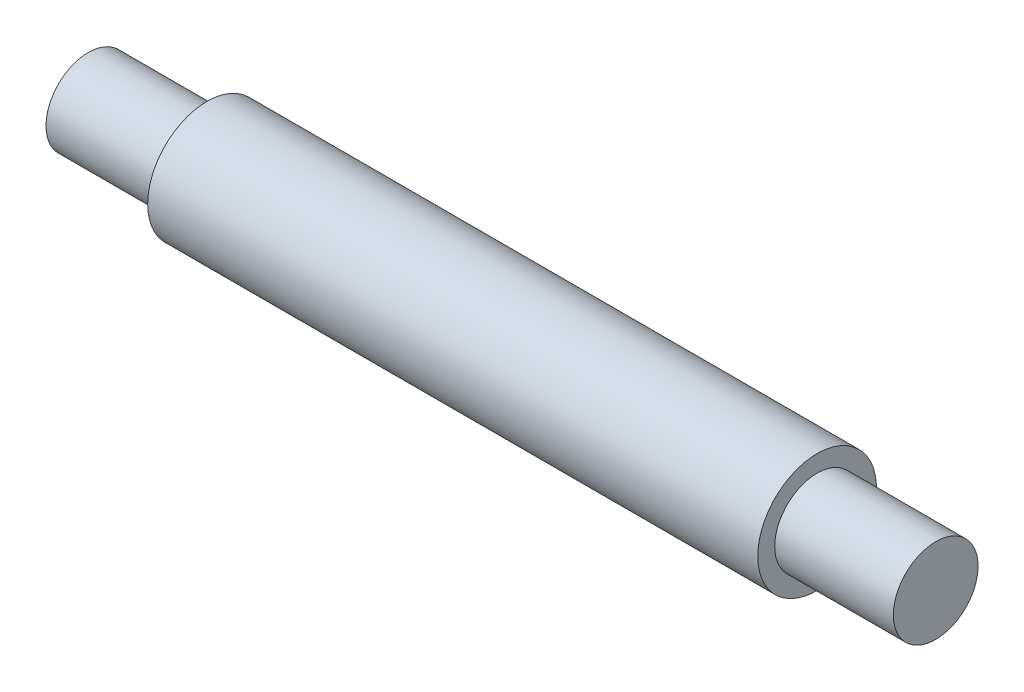
from build123d import *


with BuildPart() as part:
    # Sketch1 → Revolve1 (revolve)
    with BuildSketch(Plane(origin=(0, 0, 0), x_dir=(1, 0, 0), z_dir=(0, 1, 0))):
        Polygon((47, 1.5), (40, 1.5), (40, 0.5), (4, 0.5), (4, 1.5), (-3, 1.5), (-3, 4), (47, 4), align=None)
    revolve(axis=Axis((-3, 0, -4), (1, 0, 0)))


solid = part.part
